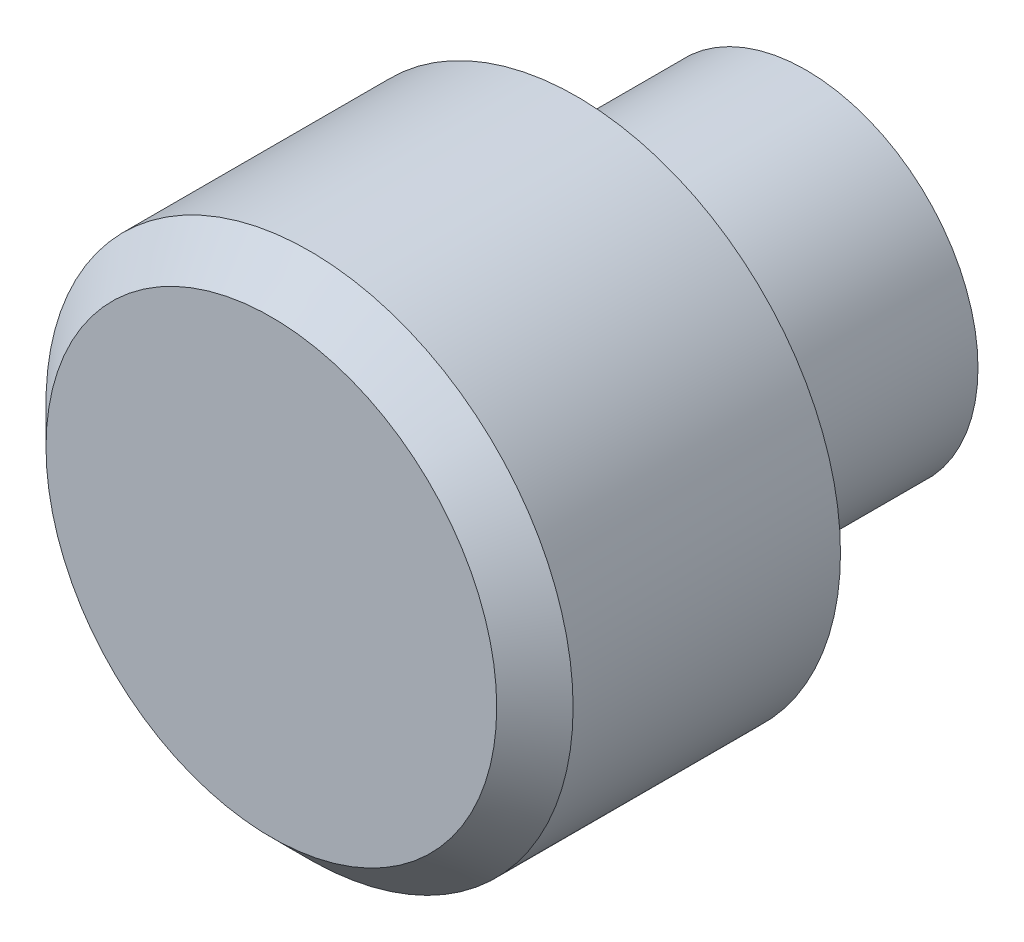
from build123d import *

# Parameters (mm, degrees)
SKETCH5_R           = 11.25
BOSS_EXTRUDE5_DEPTH = 15
SKETCH6_R           = 17.25
BOSS_EXTRUDE6_DEPTH = 20
CHAMFER2_SIZE       = 2.5


with BuildPart() as part:
    # Sketch5 → Boss-Extrude5 (new body)
    with BuildSketch(Plane.XY):
        Circle(SKETCH5_R)
    extrude(amount=BOSS_EXTRUDE5_DEPTH)

    # Sketch6 → Boss-Extrude6 (add)
    with BuildSketch(Plane.XY.offset(15)):
        Circle(SKETCH6_R)
    extrude(amount=BOSS_EXTRUDE6_DEPTH)

    # Chamfer2
    chamfer2_edges = [part.edges().sort_by_distance(p)[0] for p in [
        (-17.25, 0, 35),
    ]]
    chamfer(chamfer2_edges, length=CHAMFER2_SIZE)


solid = part.part
